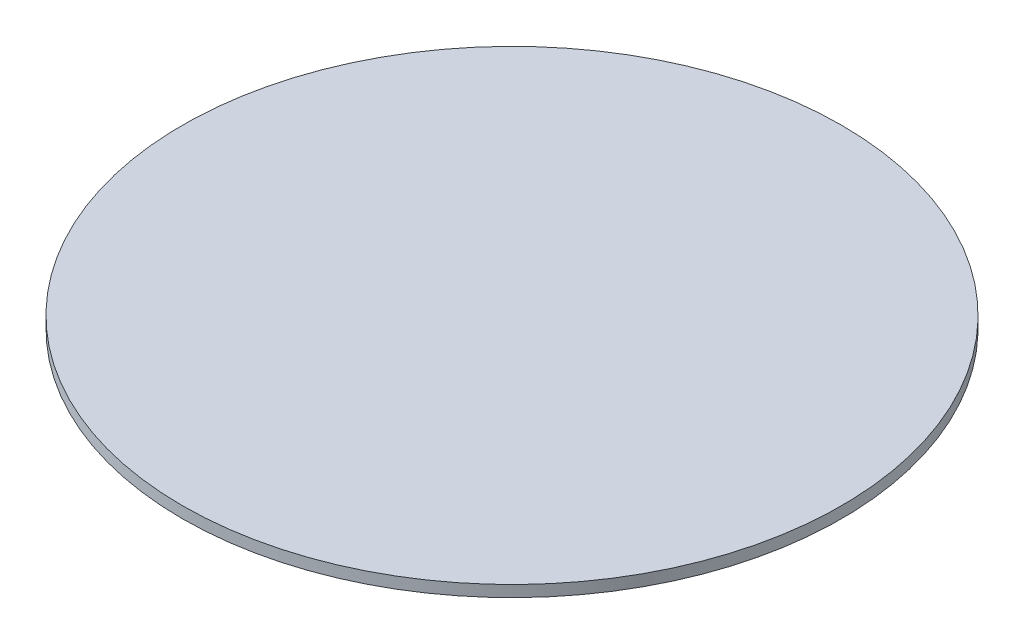
from build123d import *

# Parameters (mm, degrees)
SKETCH_1_R      = 145
EXTRUDE_1_DEPTH = 5


with BuildPart() as part:
    # 草图1 → 凸台-拉伸1 (new body)
    with BuildSketch(Plane(origin=(0, 0, 0), x_dir=(1, 0, 0), z_dir=(0, 1, 0))):
        with Locations(Location((0, 0, 0), (0, 0, 270))):
            Circle(SKETCH_1_R)
    extrude(amount=EXTRUDE_1_DEPTH)


solid = part.part
